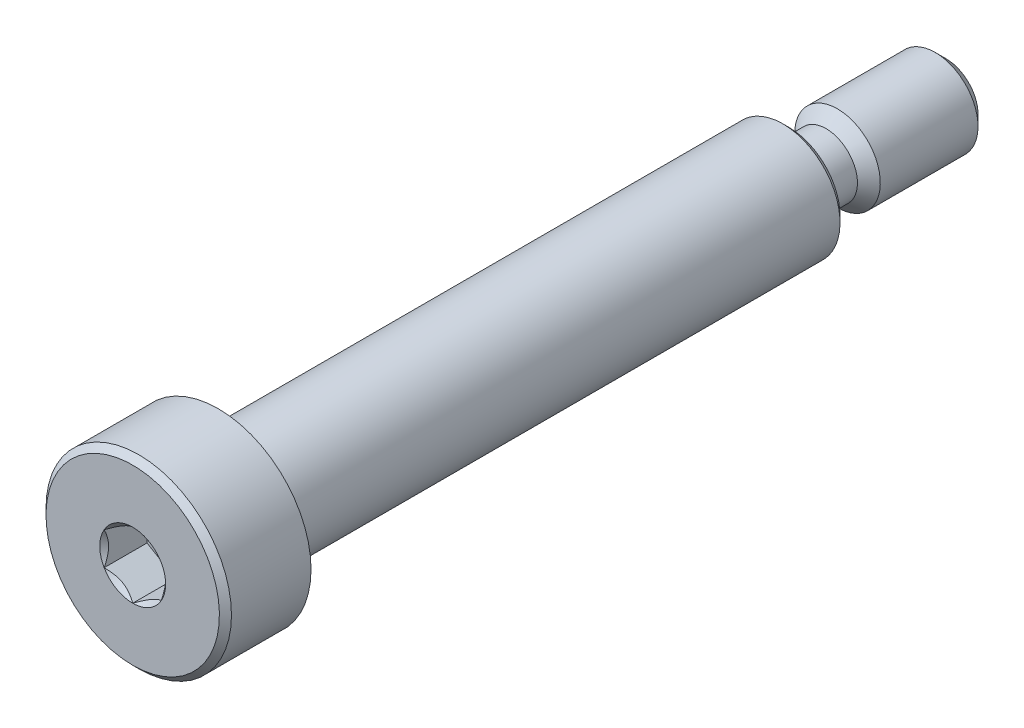
from build123d import *

# Parameters (mm, degrees)
SKETCH12_W         = 0.866666667
SKETCH12_H         = 0.866666667
CHAMFER3_SIZE      = 0.26
CHAMFER1_SIZE      = 0.75
CHAMFER2_SIZE      = 0.4225
CUT_EXTRUDE2_DEPTH = 3


with BuildPart() as part:
    # Sketch1 → Revolve1 (revolve)
    with BuildSketch(Plane(origin=(0, 0, 0), x_dir=(0, 0, -1), z_dir=(1, 0, 0))):
        Polygon((0, 6.5), (6, 6.5), (6, 4), (46, 4), (46, 3), (57, 3), (57, 0), (0, 0), align=None)
    revolve(axis=Axis((0, 0, -57), (0, 0, 1)))

    # Sketch12 → Cut-Revolve2 (revolve, cut)
    with BuildSketch(Plane(origin=(0, 0, 0), x_dir=(0, 0, -1), z_dir=(1, 0, 0))):
        with Locations((6.433333334, 3.566666667)):
            Rectangle(SKETCH12_W, SKETCH12_H)
    revolve(axis=Axis((0, 0, -57), (0, 0, 1)), mode=Mode.SUBTRACT)

    # Chamfer3
    chamfer3_edges = [part.edges().sort_by_distance(p)[0] for p in [
        (0, -4, -6.866666667),
        (0, -3.133333333, -6.866666667),
    ]]
    chamfer(chamfer3_edges, length=CHAMFER3_SIZE)

    # Sketch5 → Cut-Revolve1 (revolve, cut)
    with BuildSketch(Plane(origin=(0, 0, 0), x_dir=(0, 0, -1), z_dir=(1, 0, 0))):
        with BuildLine():
            Line((46, 4), (50.4, 4))
            Line((50.4, 4), (48.6, 2.2))
            Line((48.6, 2.2), (46.8, 2.2))
            ThreePointArc((46.8, 2.2), (46.234314575, 2.434314575), (46, 3))
            Line((46, 3), (46, 4))
        make_face()
    revolve(axis=Axis((0, 0, -57), (0, 0, 1)), mode=Mode.SUBTRACT)

    # Chamfer1
    chamfer1_edges = [part.edges().sort_by_distance(p)[0] for p in [
        (0, -3, -57),
    ]]
    chamfer(chamfer1_edges, length=CHAMFER1_SIZE)

    # Chamfer2
    chamfer2_edges = [part.edges().sort_by_distance(p)[0] for p in [
        (0, -6.5, 0),
        (0, -4, -46),
    ]]
    chamfer(chamfer2_edges, length=CHAMFER2_SIZE)

    # Sketch8 → Cut-Extrude2 (cut)
    with BuildSketch(Plane.XY):
        Polygon((2, 1.154700538), (0, 2.309401077), (-2, 1.154700538), (-2, -1.154700538), (0, -2.309401077), (2, -1.154700538), align=None)
    extrude(amount=-CUT_EXTRUDE2_DEPTH, mode=Mode.SUBTRACT)

    # Cut-Extrude4 cone 1 section (through the dimple's axis) → Cut-Extrude4 (revolve, cut)
    with BuildSketch(Plane(origin=(0, 0, 0), x_dir=(0, -1, 0), z_dir=(1, 0, 0))):
        Polygon((0, 0), (2.309401077, 0), (0, 2.309401077), align=None)
    revolve(axis=Axis((0, 0, 0), (0, 0, -1)), mode=Mode.SUBTRACT)


solid = part.part
